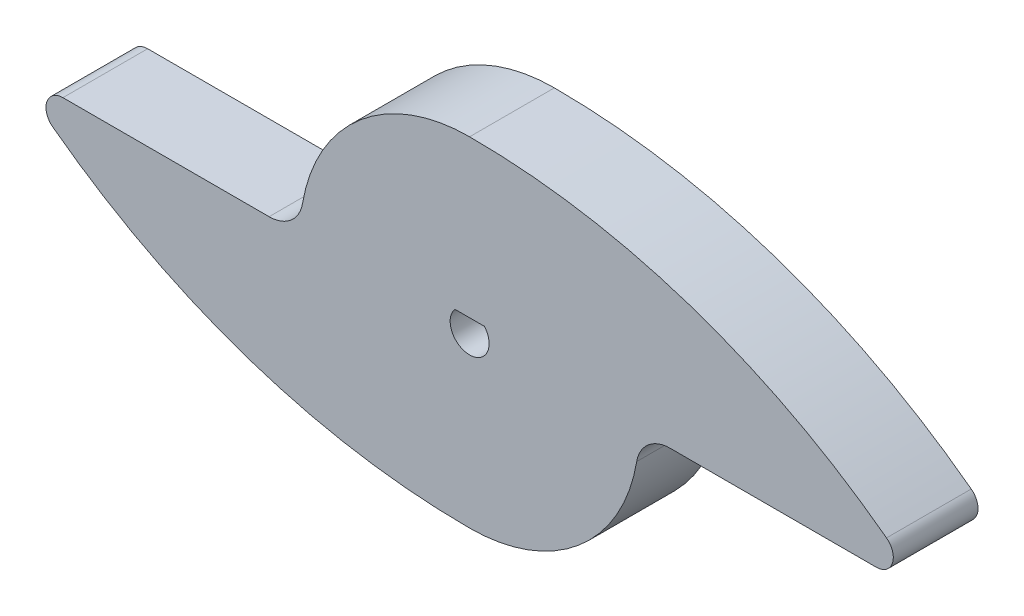
from build123d import *

# Parameters (mm, degrees)
BOSS_EXTRUDE1_DEPTH = 6.35
BOSS_EXTRUDE2_START = -11.1125
SKETCH2_R           = 3.175
BOSS_EXTRUDE2_DEPTH = 11.1125


with BuildPart() as part:
    # Sketch1 → Boss-Extrude1 (new body)
    with BuildSketch(Plane.XY):
        with BuildLine():
            Line((15.026842649, 0), (30.48, 0))
            ThreePointArc((30.48, 0), (31.684827789, 0.868390737), (31.242, 2.286))
            ThreePointArc((31.242, 2.286), (16.465979776, 10.027939329), (0, 12.7))
            ThreePointArc((0, 12.7), (-8.197814749, 9.699785221), (-12.522368874, 2.116666667))
            ThreePointArc((-12.522368874, 2.116666667), (-13.387279699, 0.600042956), (-15.026842649, 0))
            Line((-15.026842649, 0), (-30.48, 0))
            ThreePointArc((-30.48, 0), (-31.684827789, -0.868390737), (-31.242, -2.286))
            ThreePointArc((-31.242, -2.286), (-16.465979776, -10.027939329), (0, -12.7))
            ThreePointArc((0, -12.7), (8.197814749, -9.699785221), (12.522368874, -2.116666667))
            ThreePointArc((12.522368874, -2.116666667), (13.387279699, -0.600042956), (15.026842649, 0))
        make_face()
        with BuildLine():
            Line((-1.107160332, 0.9525), (1.107160332, 0.9525))
            ThreePointArc((1.107160332, 0.9525), (0, -1.4605), (-1.107160332, 0.9525))
        make_face(mode=Mode.SUBTRACT)
    extrude(amount=BOSS_EXTRUDE1_DEPTH)

    # Sketch2 → Boss-Extrude2 (add)
    with BuildSketch(Plane.XY.offset(6.35).offset(BOSS_EXTRUDE2_START)):
        Circle(SKETCH2_R)
        with BuildLine():
            Line((-1.107160332, 0.9525), (1.107160332, 0.9525))
            ThreePointArc((1.107160332, 0.9525), (0, -1.4605), (-1.107160332, 0.9525))
        make_face(mode=Mode.SUBTRACT)
    extrude(amount=BOSS_EXTRUDE2_DEPTH)


solid = part.part
